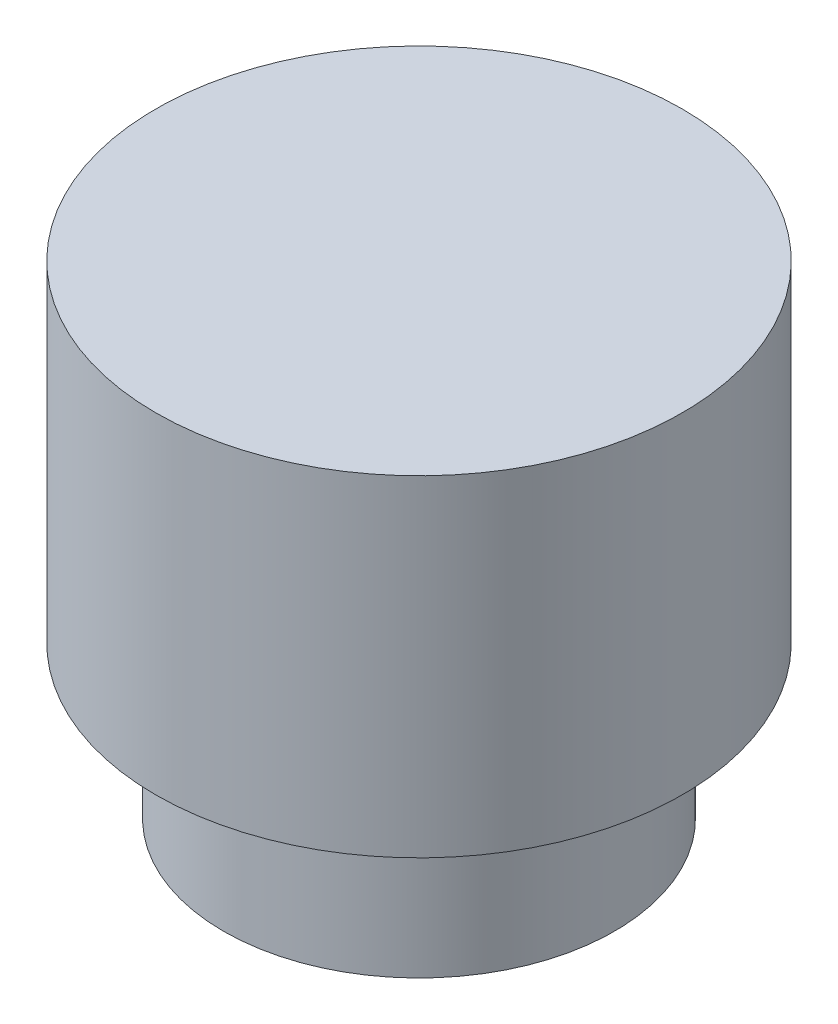
from build123d import *

# Parameters (mm, degrees)
SKETCH1_R           = 1.75
BOSS_EXTRUDE1_DEPTH = 2.2
SKETCH2_R           = 1.3
BOSS_EXTRUDE2_DEPTH = 1.01


with BuildPart() as part:
    # Sketch1 → Boss-Extrude1 (new body)
    with BuildSketch(Plane(origin=(0, 0, 0), x_dir=(1, 0, 0), z_dir=(0, 1, 0))):
        with Locations(Location((0, 0, 0), (0, 0, 270))):
            Circle(SKETCH1_R)
    extrude(amount=-BOSS_EXTRUDE1_DEPTH)

    # Sketch2 → Boss-Extrude2 (add)
    with BuildSketch(Plane.XZ.offset(2.2)):
        with Locations(Location((0, 0, 0), (0, 0, 270))):
            Circle(SKETCH2_R)
    extrude(amount=BOSS_EXTRUDE2_DEPTH)


solid = part.part
